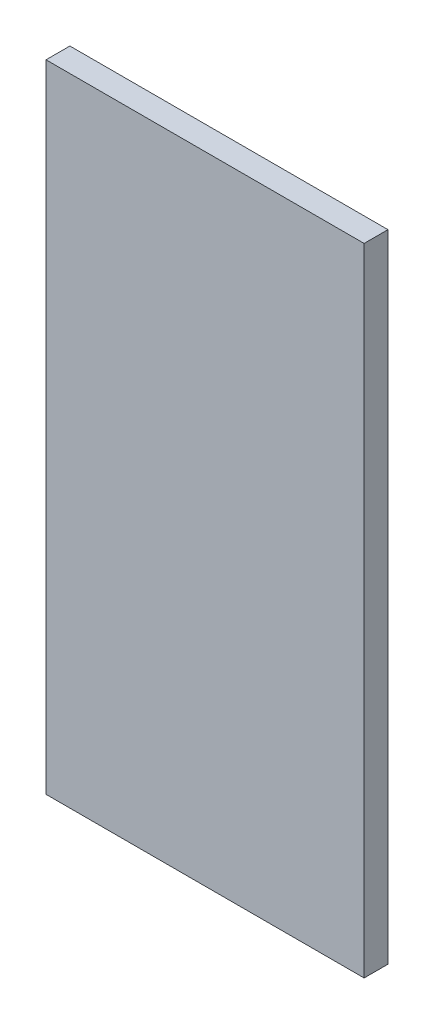
from build123d import *

# Parameters (mm, degrees)
SKETCH_1_W      = 20
SKETCH_1_H      = 40
EXTRUDE_1_DEPTH = 1.5


with BuildPart() as part:
    # 草图1 → 凸台-拉伸1 (new body)
    with BuildSketch(Plane.XY):
        Rectangle(SKETCH_1_W, SKETCH_1_H)
    extrude(amount=EXTRUDE_1_DEPTH)


solid = part.part
